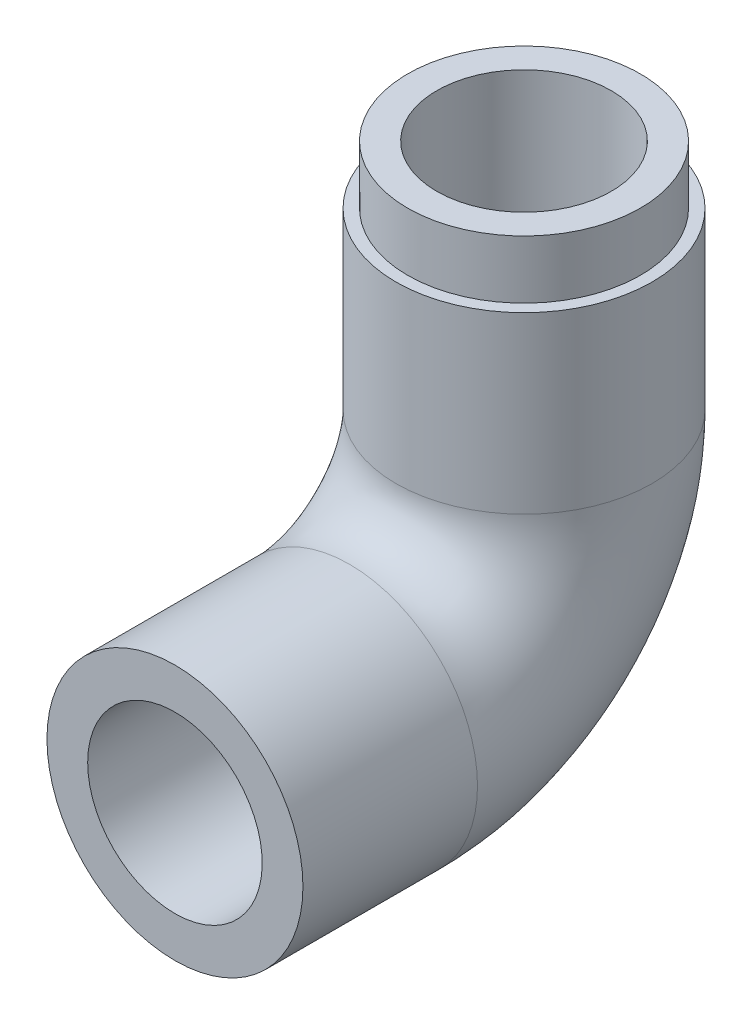
from build123d import *
from build123d.topology import SkipClean

# Parameters (mm, degrees)
SWEEP1_PROFILE_R     = 11
CUT_SWEEP1_PROFILE_R = 7.5
SKETCH34_R           = 10
SKETCH34_R_2         = 7.5
BOSS_EXTRUDE1_DEPTH  = 5


with BuildPart() as part:
    # Sweep1: sweep along a path in Sketch1
    with BuildLine(Plane(origin=(0, 0, 0), x_dir=(0, 0, -1), z_dir=(1, 0, 0))) as sweep1_path:
        Line((0, 0), (0, -15))
        ThreePointArc((0, -15), (-4.393398282, -25.606601718), (-15, -30))
        Line((-15, -30), (-30, -30))
    # Sweep1 profile (on start of the path) → Sweep1 (sweep)
    with BuildSketch(Plane(origin=(0, 0, 0), x_dir=(0, 0, -1), z_dir=(0, -1, 0))):
        Circle(SWEEP1_PROFILE_R)
    sweep(path=sweep1_path.line)

    # Cut-Sweep1: sweep along a path in Sketch1<2>
    with BuildLine(Plane(origin=(0, 0, 0), x_dir=(0, 0, -1), z_dir=(1, 0, 0))) as cut_sweep1_path:
        Line((0, 0), (0, -15))
        ThreePointArc((0, -15), (-4.393398282, -25.606601718), (-15, -30))
        Line((-15, -30), (-30, -30))
    # Cut-Sweep1 profile (on start of the path) → Cut-Sweep1 (sweep, cut)
    with BuildSketch(Plane(origin=(0, 0, 0), x_dir=(0, 0, -1), z_dir=(0, -1, 0))):
        Circle(CUT_SWEEP1_PROFILE_R)
    sweep(path=cut_sweep1_path.line, mode=Mode.SUBTRACT)

    # Sketch34 → Boss-Extrude1 (add)
    with SkipClean():  # the faces are left unmerged after this step: merging them gives an invalid solid
        with BuildSketch(Plane(origin=(0, 0, 0), x_dir=(1, 0, 0), z_dir=(0, 1, 0))):
            Circle(SKETCH34_R)
            Circle(SKETCH34_R_2, mode=Mode.SUBTRACT)
        extrude(amount=BOSS_EXTRUDE1_DEPTH)


solid = part.part
